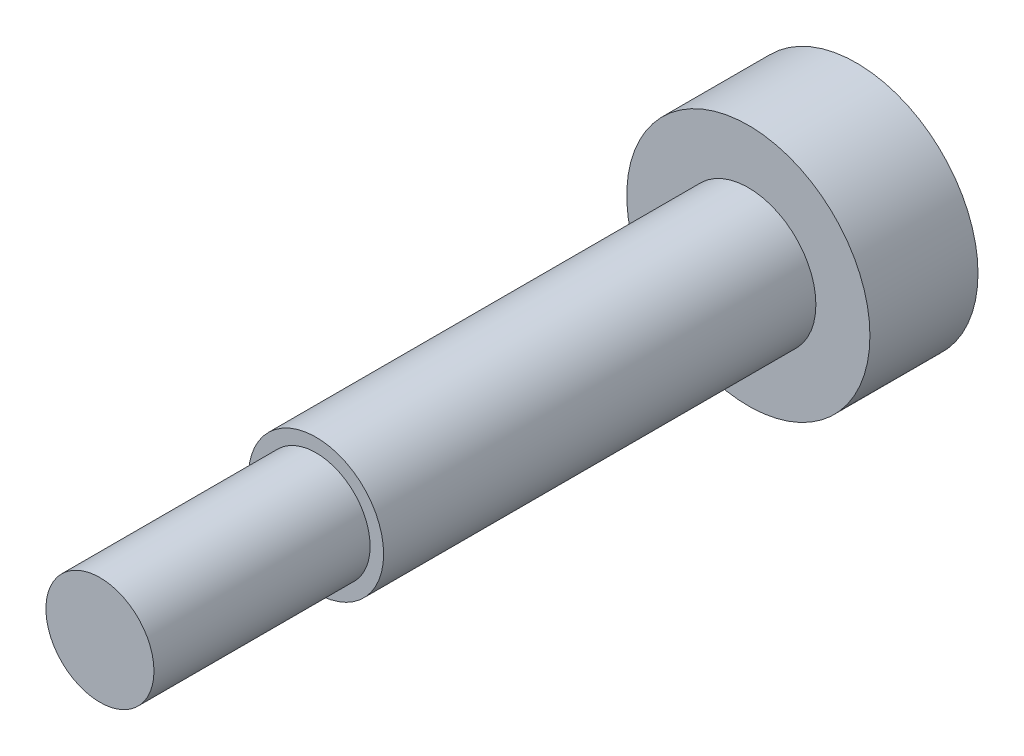
from build123d import *

# Parameters (mm, degrees)
S01_GROUND_BEARING_SHOULDER_R      = 2.5
F_01_GROUND_BEARING_SHOULDER_DEPTH = 16
F_02_START                         = 16
S02_M4_RETAINING_THREAD_R          = 2
F_02_M4_RETAINING_THREAD_DEPTH     = 8
F_03_START                         = -4
S03_SOCKET_HEAD_R                  = 4.5
F_03_SOCKET_HEAD_DEPTH             = 4
F_04_START                         = -4.1
F_04_2_5_MM_HEX_KEY_DEPTH          = 2.8


with BuildPart() as part:
    # S01 - Ground bearing shoulder → 01 - Ground bearing shoulder (new body)
    with BuildSketch(Plane.XY):
        Circle(S01_GROUND_BEARING_SHOULDER_R)
    extrude(amount=F_01_GROUND_BEARING_SHOULDER_DEPTH)

    # S02 - M4 retaining thread → 02 - M4 retaining thread (add)
    with BuildSketch(Plane.XY.offset(F_02_START)):
        Circle(S02_M4_RETAINING_THREAD_R)
    extrude(amount=F_02_M4_RETAINING_THREAD_DEPTH)

    # S03 - Socket head → 03 - Socket head (add)
    with BuildSketch(Plane.XY.offset(F_03_START)):
        Circle(S03_SOCKET_HEAD_R)
    extrude(amount=F_03_SOCKET_HEAD_DEPTH)

    # S04 - 2.5 mm hex key → 04 - 2.5 mm hex key (cut)
    with BuildSketch(Plane.XY.offset(F_04_START)):
        Polygon((1.443375673, 0), (0.721687836, 1.25), (-0.721687836, 1.25), (-1.443375673, 0), (-0.721687836, -1.25), (0.721687836, -1.25), align=None)
    extrude(amount=F_04_2_5_MM_HEX_KEY_DEPTH, mode=Mode.SUBTRACT)


solid = part.part
